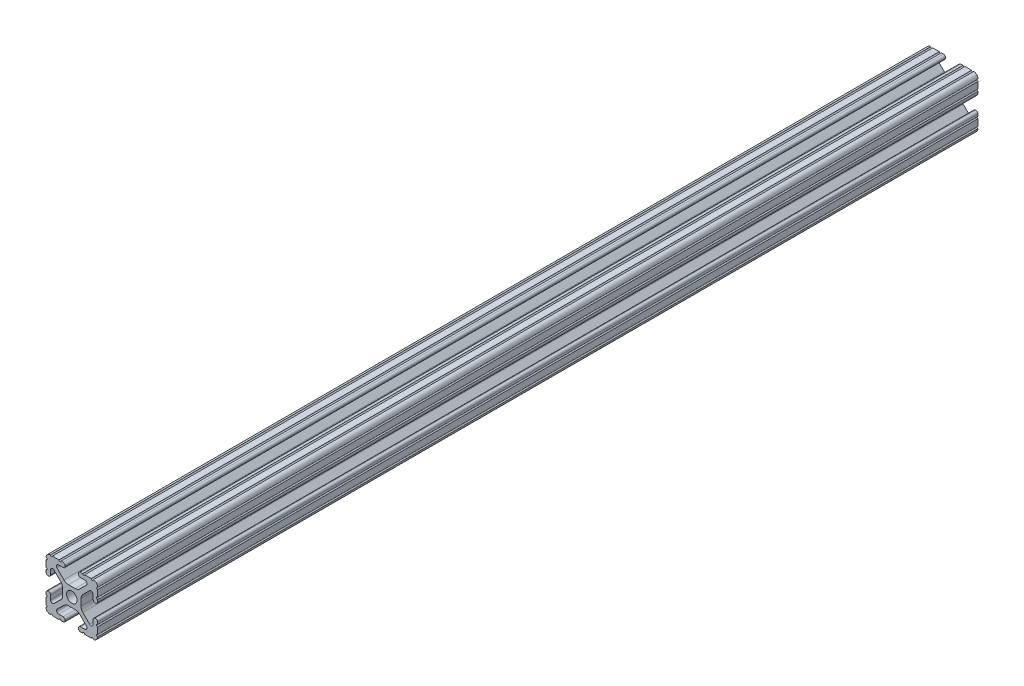
from build123d import *

# Parameters (mm, degrees)
SKETCH1_R           = 2.6035
BOSS_EXTRUDE1_DEPTH = 304.8
SKETCH2_W           = 49.977266258
SKETCH2_H           = 47.000485055
CUT_EXTRUDE1_DEPTH  = 176.53


with BuildPart() as part:
    # Sketch1 → Boss-Extrude1 (new, symmetric)
    with BuildSketch(Plane.XY):
        with BuildLine():
            Line((-7.179650497, -8.645192506), (-3.952270251, -5.423690499))
            ThreePointArc((-3.952270251, -5.423690499), (-2.922936451, -4.736929036), (-1.709253557, -4.4958))
            Line((-1.709253557, -4.4958), (1.709253557, -4.4958))
            ThreePointArc((1.709253557, -4.4958), (2.922936451, -4.736929036), (3.952270251, -5.423690499))
            Line((3.952270251, -5.423690499), (7.179650497, -8.645192506))
            ThreePointArc((7.179650497, -8.645192506), (7.41473083, -9.822813117), (6.416408329, -10.4902))
            Line((6.416408329, -10.4902), (4.287512407, -10.4902))
            ThreePointArc((4.287512407, -10.4902), (3.54574862, -10.79744862), (3.2385, -11.539212407))
            Line((3.2385, -11.539212407), (3.2385, -11.650987593))
            ThreePointArc((3.2385, -11.650987593), (3.54574862, -12.39275138), (4.287512407, -12.7))
            Line((4.287512407, -12.7), (5.317126718, -12.7))
            ThreePointArc((5.317126718, -12.7), (5.825126718, -12.192), (6.333126718, -12.7))
            Line((6.333126718, -12.7), (9.550443118, -12.7))
            ThreePointArc((9.550443118, -12.7), (10.058366869, -12.192000006), (10.566443095, -12.699847501))
            ThreePointArc((10.566443095, -12.699847501), (12.082537762, -12.08250727), (12.699846982, -10.566399977))
            ThreePointArc((12.699846982, -10.566399977), (12.192000006, -10.058323491), (12.7, -9.5504))
            Line((12.7, -9.5504), (12.7, -6.3330836))
            ThreePointArc((12.7, -6.3330836), (12.192, -5.8250836), (12.7, -5.3170836))
            Line((12.7, -5.3170836), (12.7, -4.287469289))
            ThreePointArc((12.7, -4.287469289), (12.39275138, -3.545705502), (11.650987593, -3.238456882))
            Line((11.650987593, -3.238456882), (11.539212407, -3.238456882))
            ThreePointArc((11.539212407, -3.238456882), (10.79744862, -3.545705502), (10.4902, -4.287469289))
            Line((10.4902, -4.287469289), (10.4902, -6.402089023))
            ThreePointArc((10.4902, -6.402089023), (9.856505071, -7.351067942), (8.737131347, -7.129408934))
            Line((8.737131347, -7.129408934), (5.441005833, -3.840816462))
            ThreePointArc((5.441005833, -3.840816462), (4.750877967, -2.809883091), (4.5085, -1.593185507))
            Line((4.5085, -1.593185507), (4.5085, 1.593185507))
            ThreePointArc((4.5085, 1.593185507), (4.750877967, 2.809883091), (5.441005833, 3.840816462))
            Line((5.441005833, 3.840816462), (8.737131347, 7.129408934))
            ThreePointArc((8.737131347, 7.129408934), (9.856505071, 7.351067942), (10.4902, 6.402089023))
            Line((10.4902, 6.402089023), (10.4902, 4.287469289))
            ThreePointArc((10.4902, 4.287469289), (10.79744862, 3.545705502), (11.539212407, 3.238456882))
            Line((11.539212407, 3.238456882), (11.650987593, 3.238456882))
            ThreePointArc((11.650987593, 3.238456882), (12.39275138, 3.545705502), (12.7, 4.287469289))
            Line((12.7, 4.287469289), (12.7, 5.3170836))
            ThreePointArc((12.7, 5.3170836), (12.192, 5.8250836), (12.7, 6.3330836))
            Line((12.7, 6.3330836), (12.7, 9.5504))
            ThreePointArc((12.7, 9.5504), (12.192000006, 10.058323491), (12.699846982, 10.566399977))
            ThreePointArc((12.699846982, 10.566399977), (12.082537762, 12.08250727), (10.566443095, 12.699847501))
            ThreePointArc((10.566443095, 12.699847501), (10.058366869, 12.192000006), (9.550443118, 12.7))
            Line((9.550443118, 12.7), (6.333126718, 12.7))
            ThreePointArc((6.333126718, 12.7), (5.825126718, 12.192), (5.317126718, 12.7))
            Line((5.317126718, 12.7), (4.287512407, 12.7))
            ThreePointArc((4.287512407, 12.7), (3.54574862, 12.39275138), (3.2385, 11.650987593))
            Line((3.2385, 11.650987593), (3.2385, 11.539212407))
            ThreePointArc((3.2385, 11.539212407), (3.54574862, 10.79744862), (4.287512407, 10.4902))
            Line((4.287512407, 10.4902), (6.476788598, 10.4902))
            ThreePointArc((6.476788598, 10.4902), (7.432222385, 9.85140422), (7.207036008, 8.724370562))
            Line((7.207036008, 8.724370562), (3.898272566, 5.423169045))
            ThreePointArc((3.898272566, 5.423169045), (2.869120213, 4.736787962), (1.655778399, 4.4958))
            Line((1.655778399, 4.4958), (-1.655778399, 4.4958))
            ThreePointArc((-1.655778399, 4.4958), (-2.869120213, 4.736787962), (-3.898272566, 5.423169045))
            Line((-3.898272566, 5.423169045), (-7.207036008, 8.724370562))
            ThreePointArc((-7.207036008, 8.724370562), (-7.432222385, 9.85140422), (-6.476788598, 10.4902))
            Line((-6.476788598, 10.4902), (-4.287512407, 10.4902))
            ThreePointArc((-4.287512407, 10.4902), (-3.54574862, 10.79744862), (-3.2385, 11.539212407))
            Line((-3.2385, 11.539212407), (-3.2385, 11.650987593))
            ThreePointArc((-3.2385, 11.650987593), (-3.54574862, 12.39275138), (-4.287512407, 12.7))
            Line((-4.287512407, 12.7), (-5.317126718, 12.7))
            ThreePointArc((-5.317126718, 12.7), (-5.825126718, 12.192), (-6.333126718, 12.7))
            Line((-6.333126718, 12.7), (-9.550443118, 12.7))
            ThreePointArc((-9.550443118, 12.7), (-10.058366869, 12.192000006), (-10.566443095, 12.699847501))
            ThreePointArc((-10.566443095, 12.699847501), (-12.082537762, 12.08250727), (-12.699846982, 10.566399977))
            ThreePointArc((-12.699846982, 10.566399977), (-12.192000006, 10.058323491), (-12.7, 9.5504))
            Line((-12.7, 9.5504), (-12.7, 6.3330836))
            ThreePointArc((-12.7, 6.3330836), (-12.192, 5.8250836), (-12.7, 5.3170836))
            Line((-12.7, 5.3170836), (-12.7, 4.287469289))
            ThreePointArc((-12.7, 4.287469289), (-12.39275138, 3.545705502), (-11.650987593, 3.238456882))
            Line((-11.650987593, 3.238456882), (-11.539212407, 3.238456882))
            ThreePointArc((-11.539212407, 3.238456882), (-10.79744862, 3.545705502), (-10.4902, 4.287469289))
            Line((-10.4902, 4.287469289), (-10.4902, 6.402089023))
            ThreePointArc((-10.4902, 6.402089023), (-9.856505071, 7.351067942), (-8.737131347, 7.129408934))
            Line((-8.737131347, 7.129408934), (-5.441005833, 3.840816462))
            ThreePointArc((-5.441005833, 3.840816462), (-4.750877967, 2.809883091), (-4.5085, 1.593185507))
            Line((-4.5085, 1.593185507), (-4.5085, -1.593185507))
            ThreePointArc((-4.5085, -1.593185507), (-4.750877967, -2.809883091), (-5.441005833, -3.840816462))
            Line((-5.441005833, -3.840816462), (-8.737131347, -7.129408934))
            ThreePointArc((-8.737131347, -7.129408934), (-9.856505071, -7.351067942), (-10.4902, -6.402089023))
            Line((-10.4902, -6.402089023), (-10.4902, -4.287469289))
            ThreePointArc((-10.4902, -4.287469289), (-10.79744862, -3.545705502), (-11.539212407, -3.238456882))
            Line((-11.539212407, -3.238456882), (-11.650987593, -3.238456882))
            ThreePointArc((-11.650987593, -3.238456882), (-12.39275138, -3.545705502), (-12.7, -4.287469289))
            Line((-12.7, -4.287469289), (-12.7, -5.3170836))
            ThreePointArc((-12.7, -5.3170836), (-12.192, -5.8250836), (-12.7, -6.3330836))
            Line((-12.7, -6.3330836), (-12.7, -9.5504))
            ThreePointArc((-12.7, -9.5504), (-12.192000006, -10.058323491), (-12.699846982, -10.566399977))
            ThreePointArc((-12.699846982, -10.566399977), (-12.082537762, -12.08250727), (-10.566443095, -12.699847501))
            ThreePointArc((-10.566443095, -12.699847501), (-10.058366869, -12.192000006), (-9.550443118, -12.7))
            Line((-9.550443118, -12.7), (-6.333126718, -12.7))
            ThreePointArc((-6.333126718, -12.7), (-5.825126718, -12.192), (-5.317126718, -12.7))
            Line((-5.317126718, -12.7), (-4.287512407, -12.7))
            ThreePointArc((-4.287512407, -12.7), (-3.54574862, -12.39275138), (-3.2385, -11.650987593))
            Line((-3.2385, -11.650987593), (-3.2385, -11.539212407))
            ThreePointArc((-3.2385, -11.539212407), (-3.54574862, -10.79744862), (-4.287512407, -10.4902))
            Line((-4.287512407, -10.4902), (-6.416408329, -10.4902))
            ThreePointArc((-6.416408329, -10.4902), (-7.41473083, -9.822813117), (-7.179650497, -8.645192506))
        make_face()
        with Locations(Location((0, 0, 0), (0, 0, 180))):
            Circle(SKETCH1_R, mode=Mode.SUBTRACT)
    extrude(amount=BOSS_EXTRUDE1_DEPTH, both=True)

    # Sketch2 → Cut-Extrude1 (cut)
    with BuildSketch(Plane.XY.offset(304.8)):
        with Locations((1.177518628, -0.126321905)):
            Rectangle(SKETCH2_W, SKETCH2_H)
    extrude(amount=-CUT_EXTRUDE1_DEPTH, mode=Mode.SUBTRACT)


solid = part.part
